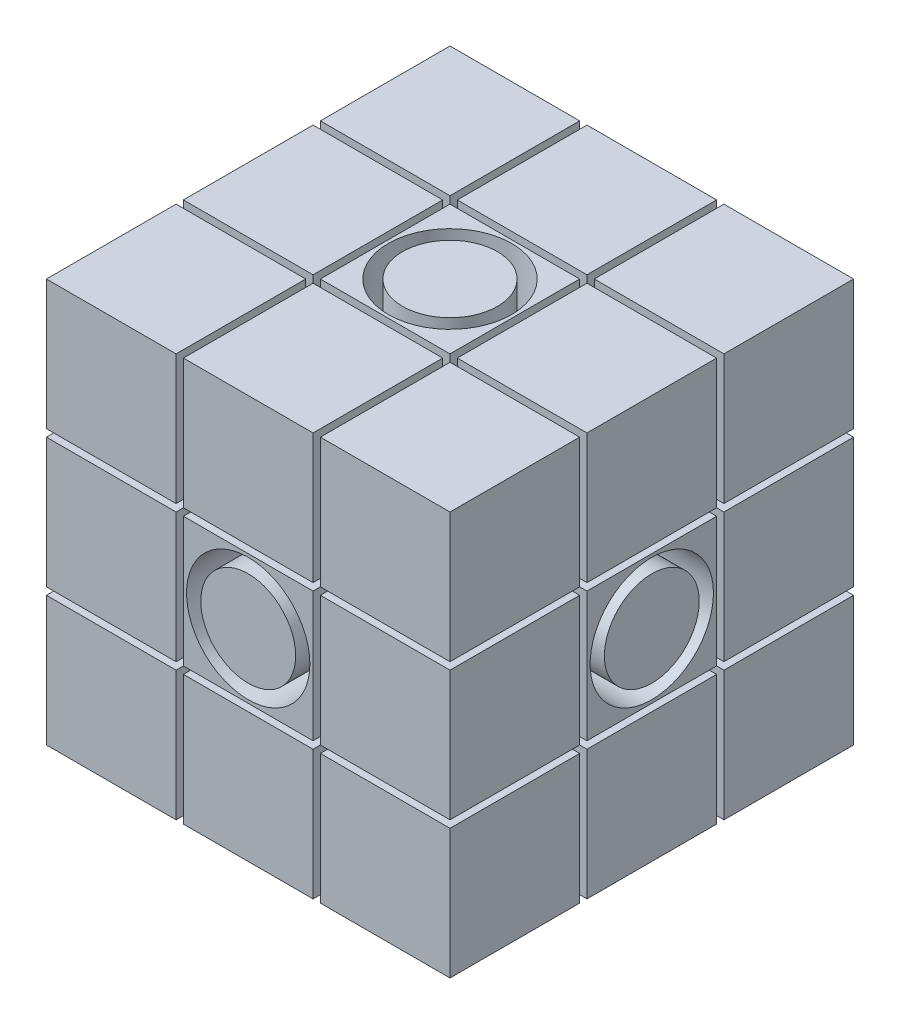
from build123d import *

# Parameters (mm, degrees)
SKETCH1_W           = 55.3
SKETCH1_H           = 55.3
BOSS_EXTRUDE1_DEPTH = 27.65
SKETCH2_R           = 8.45
SKETCH2_R_2         = 6.5
CUT_EXTRUDE2_DEPTH  = 9.5
CUT_EXTRUDE3_START  = -9.5
SKETCH3_R           = 8.45
SKETCH3_R_2         = 6.5
CUT_EXTRUDE3_DEPTH  = 9.5
SKETCH4_R           = 8.45
SKETCH4_R_2         = 6.5
CUT_EXTRUDE4_DEPTH  = 9.5
CUT_EXTRUDE5_START  = -9.5
SKETCH5_R           = 8.45
SKETCH5_R_2         = 6.5
CUT_EXTRUDE5_DEPTH  = 9.5
SKETCH6_R           = 8.45
SKETCH6_R_2         = 6.5
CUT_EXTRUDE6_DEPTH  = 9.5
CUT_EXTRUDE7_START  = -9.5
SKETCH7_R           = 8.45
SKETCH7_R_2         = 6.5
CUT_EXTRUDE7_DEPTH  = 9.5
SKETCH8_W           = 17.76666667
SKETCH8_H           = 17.76666667
CUT_EXTRUDE8_DEPTH  = 30
SKETCH10_W          = 55.3
SKETCH10_H          = 1
CUT_EXTRUDE9_DEPTH  = 60


with BuildPart() as part:
    # Sketch1 → Boss-Extrude1 (new, symmetric)
    with BuildSketch(Plane(origin=(0, 0, 0), x_dir=(1, 0, 0), z_dir=(0, 1, 0))):
        Rectangle(SKETCH1_W, SKETCH1_H)
    extrude(amount=BOSS_EXTRUDE1_DEPTH, both=True)

    # Sketch2 → Cut-Extrude2 (cut)
    with BuildSketch(Plane(origin=(0, 27.65, 0), x_dir=(1, 0, 0), z_dir=(0, 1, 0))):
        with Locations(Location((0, 0, 0), (0, 0, 270))):
            Circle(SKETCH2_R)
        with Locations(Location((0, 0, 0), (0, 0, 270))):
            Circle(SKETCH2_R_2, mode=Mode.SUBTRACT)
    extrude(amount=-CUT_EXTRUDE2_DEPTH, mode=Mode.SUBTRACT)

    # Sketch3 → Cut-Extrude3 (cut)
    with BuildSketch(Plane.XZ.offset(27.65).offset(CUT_EXTRUDE3_START)):
        with Locations(Location((0, 0, 0), (0, 0, 90))):
            Circle(SKETCH3_R)
        with Locations(Location((0, 0, 0), (0, 0, 90))):
            Circle(SKETCH3_R_2, mode=Mode.SUBTRACT)
    extrude(amount=CUT_EXTRUDE3_DEPTH, mode=Mode.SUBTRACT)

    # Sketch4 → Cut-Extrude4 (cut)
    with BuildSketch(Plane(origin=(27.65, 0, 0), x_dir=(0, 0, -1), z_dir=(1, 0, 0))):
        Circle(SKETCH4_R)
        Circle(SKETCH4_R_2, mode=Mode.SUBTRACT)
    extrude(amount=-CUT_EXTRUDE4_DEPTH, mode=Mode.SUBTRACT)

    # Sketch5 → Cut-Extrude5 (cut)
    with BuildSketch(Plane.ZY.offset(27.65).offset(CUT_EXTRUDE5_START)):
        with Locations(Location((0, 0, 0), (0, 0, 180))):
            Circle(SKETCH5_R)
        with Locations(Location((0, 0, 0), (0, 0, 180))):
            Circle(SKETCH5_R_2, mode=Mode.SUBTRACT)
    extrude(amount=CUT_EXTRUDE5_DEPTH, mode=Mode.SUBTRACT)

    # Sketch6 → Cut-Extrude6 (cut)
    with BuildSketch(Plane.XY.offset(27.65)):
        Circle(SKETCH6_R)
        Circle(SKETCH6_R_2, mode=Mode.SUBTRACT)
    extrude(amount=-CUT_EXTRUDE6_DEPTH, mode=Mode.SUBTRACT)

    # Sketch7 → Cut-Extrude7 (cut)
    with BuildSketch(Plane(origin=(0, 0, -27.65), x_dir=(-1, 0, 0), z_dir=(0, 0, -1)).offset(CUT_EXTRUDE7_START)):
        with Locations(Location((0, 0, 0), (0, 0, 180))):
            Circle(SKETCH7_R)
        with Locations(Location((0, 0, 0), (0, 0, 180))):
            Circle(SKETCH7_R_2, mode=Mode.SUBTRACT)
    extrude(amount=CUT_EXTRUDE7_DEPTH, mode=Mode.SUBTRACT)

    # Sketch8 → Cut-Extrude8 (cut, symmetric)
    with BuildSketch(Plane(origin=(0, 0, 0), x_dir=(1, 0, 0), z_dir=(0, 1, 0))):
        Polygon((-9.88333333, 27.65), (-9.88333333, 9.883333333), (-27.65, 9.883333333), (-27.65, 8.883333333), (-9.88333334, 8.883333333), (-9.88333334, -8.883333337), (-27.65, -8.883333337), (-27.65, -9.883333337), (-9.88333334, -9.883333337), (-9.88333334, -27.650000007), (-8.88333334, -27.65), (-8.88333334, -9.883333337), (8.88333333, -9.883333337), (8.88333333, -27.65), (9.88333333, -27.65), (9.88333333, -9.883333337), (27.65, -9.883333337), (27.65, -8.883333337), (9.88333333, -8.883333337), (9.88333333, 8.883333333), (27.65, 8.883333333), (27.65, 9.883333333), (9.88333334, 9.883333333), (9.88333334, 27.65), (8.88333334, 27.65), (8.88333334, 9.883333333), (-8.88333333, 9.883333333), (-8.88333333, 27.65), align=None)
        with Locations((-5e-09, -2e-09)):
            Rectangle(SKETCH8_W, SKETCH8_H, mode=Mode.SUBTRACT)
    extrude(amount=CUT_EXTRUDE8_DEPTH, both=True, mode=Mode.SUBTRACT)


with BuildPart() as cut_extrude8_piece_1:
    # of the separate pieces the step leaves, piece 1, a body of its own (cut_extrude8_pieces)
    add(part.part.solids().sort_by_distance((-27.65, -27.65, -27.65))[0])


with BuildPart() as cut_extrude8_piece_2:
    # of the separate pieces the step leaves, piece 2, a body of its own (cut_extrude8_pieces)
    add(part.part.solids().sort_by_distance((27.65, 27.65, 9.883333337))[0])


with BuildPart() as cut_extrude8_piece_3:
    # of the separate pieces the step leaves, piece 3, a body of its own (cut_extrude8_pieces)
    add(part.part.solids().sort_by_distance((9.88333334, 27.65, -27.65))[0])


with BuildPart() as cut_extrude8_piece_4:
    # of the separate pieces the step leaves, piece 4, a body of its own (cut_extrude8_pieces)
    add(part.part.solids().sort_by_distance((-27.65, 27.65, 27.65))[0])


with BuildPart() as cut_extrude8_piece_5:
    # of the separate pieces the step leaves, piece 5, a body of its own (cut_extrude8_pieces)
    add(part.part.solids().sort_by_distance((27.65, 27.65, -8.883333333))[0])


with BuildPart() as cut_extrude8_piece_6:
    # of the separate pieces the step leaves, piece 6, a body of its own (cut_extrude8_pieces)
    add(part.part.solids().sort_by_distance((-8.88333333, 27.65, -27.65))[0])


with BuildPart() as cut_extrude8_piece_7:
    # of the separate pieces the step leaves, piece 7, a body of its own (cut_extrude8_pieces)
    add(part.part.solids().sort_by_distance((8.88333333, 27.65, 27.65))[0])


with BuildPart() as cut_extrude8_piece_8:
    # of the separate pieces the step leaves, piece 8, a body of its own (cut_extrude8_pieces)
    add(part.part.solids().sort_by_distance((-27.65, -27.65, 8.883333337))[0])


with BuildPart() as cut_extrude8_piece_9:
    # of the separate pieces the step leaves, piece 9, a body of its own (cut_extrude8_pieces)
    add(part.part.solids().sort_by_distance((-8.88333334, 27.65, -8.883333333))[0])


with BuildPart() as cut_extrude9_tool:
    # Sketch10 → Cut-Extrude9 (new, symmetric)
    with BuildSketch(Plane.XY):
        with Locations((0, 9.38333333)):
            Rectangle(SKETCH10_W, SKETCH10_H)
        with Locations((0, -9.38333334)):
            Rectangle(SKETCH10_W, SKETCH10_H)
    extrude(amount=CUT_EXTRUDE9_DEPTH, both=True)


with BuildPart() as cut_extrude8_piece_1_1:
    add(cut_extrude8_piece_1.part)

    # Cut-Extrude9: cut by cut_extrude9_tool
    add(cut_extrude9_tool.part, mode=Mode.SUBTRACT)


with BuildPart() as cut_extrude8_piece_2_1:
    add(cut_extrude8_piece_2.part)

    # Cut-Extrude9: cut by cut_extrude9_tool
    add(cut_extrude9_tool.part, mode=Mode.SUBTRACT)


with BuildPart() as cut_extrude8_piece_3_1:
    add(cut_extrude8_piece_3.part)

    # Cut-Extrude9: cut by cut_extrude9_tool
    add(cut_extrude9_tool.part, mode=Mode.SUBTRACT)


with BuildPart() as cut_extrude8_piece_4_1:
    add(cut_extrude8_piece_4.part)

    # Cut-Extrude9: cut by cut_extrude9_tool
    add(cut_extrude9_tool.part, mode=Mode.SUBTRACT)


with BuildPart() as cut_extrude8_piece_5_1:
    add(cut_extrude8_piece_5.part)

    # Cut-Extrude9: cut by cut_extrude9_tool
    add(cut_extrude9_tool.part, mode=Mode.SUBTRACT)


with BuildPart() as cut_extrude8_piece_6_1:
    add(cut_extrude8_piece_6.part)

    # Cut-Extrude9: cut by cut_extrude9_tool
    add(cut_extrude9_tool.part, mode=Mode.SUBTRACT)


with BuildPart() as cut_extrude8_piece_7_1:
    add(cut_extrude8_piece_7.part)

    # Cut-Extrude9: cut by cut_extrude9_tool
    add(cut_extrude9_tool.part, mode=Mode.SUBTRACT)


with BuildPart() as cut_extrude8_piece_8_1:
    add(cut_extrude8_piece_8.part)

    # Cut-Extrude9: cut by cut_extrude9_tool
    add(cut_extrude9_tool.part, mode=Mode.SUBTRACT)


with BuildPart() as cut_extrude8_piece_9_1:
    add(cut_extrude8_piece_9.part)

    # Cut-Extrude9: cut by cut_extrude9_tool
    add(cut_extrude9_tool.part, mode=Mode.SUBTRACT)


solid = Compound([cut_extrude8_piece_1_1.part, cut_extrude8_piece_2_1.part, cut_extrude8_piece_3_1.part, cut_extrude8_piece_4_1.part, cut_extrude8_piece_5_1.part, cut_extrude8_piece_6_1.part, cut_extrude8_piece_7_1.part, cut_extrude8_piece_8_1.part, cut_extrude8_piece_9_1.part])
